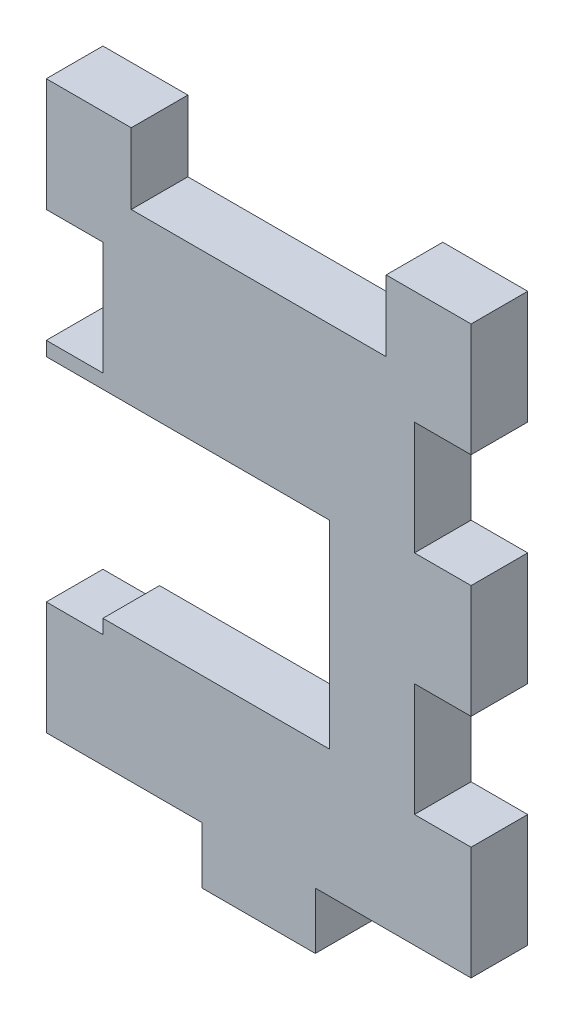
from build123d import *

# Parameters (mm, degrees)
SKETCH1_W           = 47.625
SKETCH1_H           = 63.5
BOSS_EXTRUDE1_DEPTH = 6.35
SKETCH2_W           = 12.7
SKETCH2_H           = 12.7
BOSS_EXTRUDE2_DEPTH = 6.35
SKETCH3_W           = 6.35
SKETCH3_H           = 12.7
CUT_EXTRUDE1_DEPTH  = 85.77904001
LPATTERN1_COUNT     = 2
LPATTERN1_PITCH     = 25.4
SKETCH4_W           = 50.8
SKETCH4_H           = 22.225
SERVO_CUT_DEPTH     = 85.77904001
SKETCH5_W           = 28.575
SKETCH5_H           = 15.875
CUT_EXTRUDE2_DEPTH  = 85.77904001


with BuildPart() as part:
    # Sketch1 → Boss-Extrude1 (new body)
    with BuildSketch(Plane.XY):
        with Locations((23.8125, 38.1)):
            Rectangle(SKETCH1_W, SKETCH1_H)
    extrude(amount=BOSS_EXTRUDE1_DEPTH)

    # Sketch2 → Boss-Extrude2 (add)
    with BuildSketch(Plane.XY.offset(6.35)):
        with Locations((23.8125, 6.35)):
            Rectangle(SKETCH2_W, SKETCH2_H)
    extrude(amount=-BOSS_EXTRUDE2_DEPTH)

    # Sketch3 → Cut-Extrude1 (cut, through all)
    with BuildSketch(Plane.XY.offset(6.35)):
        with Locations((3.175, 25.4)):
            Rectangle(SKETCH3_W, SKETCH3_H)
        with Locations((44.45, 25.4)):
            Rectangle(SKETCH3_W, SKETCH3_H)
    cut_extrude1 = extrude(amount=-CUT_EXTRUDE1_DEPTH, mode=Mode.SUBTRACT)

    # LPattern1: Cut-Extrude1 ×2
    with Locations(*[(0, i * LPATTERN1_PITCH, 0) for i in range(1, LPATTERN1_COUNT)]):
        add(cut_extrude1, mode=Mode.SUBTRACT)

    # Sketch4 → Servo Cut (cut, through all)
    with BuildSketch(Plane.XY.offset(6.35)):
        with Locations((6.35, 31.75)):
            Rectangle(SKETCH4_W, SKETCH4_H)
    extrude(amount=-SERVO_CUT_DEPTH, mode=Mode.SUBTRACT)

    # Sketch5 → Cut-Extrude2 (cut, through all)
    with BuildSketch(Plane.XY.offset(6.35)):
        with Locations((23.8125, 69.85)):
            Rectangle(SKETCH5_W, SKETCH5_H)
    extrude(amount=-CUT_EXTRUDE2_DEPTH, mode=Mode.SUBTRACT)


solid = part.part
